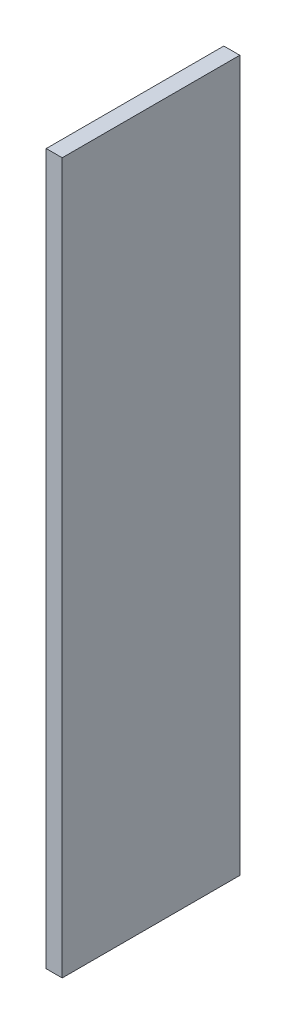
from build123d import *

# Parameters (mm, degrees)
SZKIC1_W                    = 200
SZKIC1_H                    = 800
DODANIE_WYCI_GNI_CIE1_DEPTH = 18


with BuildPart() as part:
    # Szkic1 → Dodanie-wyciągnięcie1 (new body)
    with BuildSketch(Plane(origin=(0, 0, 0), x_dir=(0, 0, -1), z_dir=(1, 0, 0))):
        with Locations((100, 400)):
            Rectangle(SZKIC1_W, SZKIC1_H)
    extrude(amount=DODANIE_WYCI_GNI_CIE1_DEPTH)


solid = part.part
